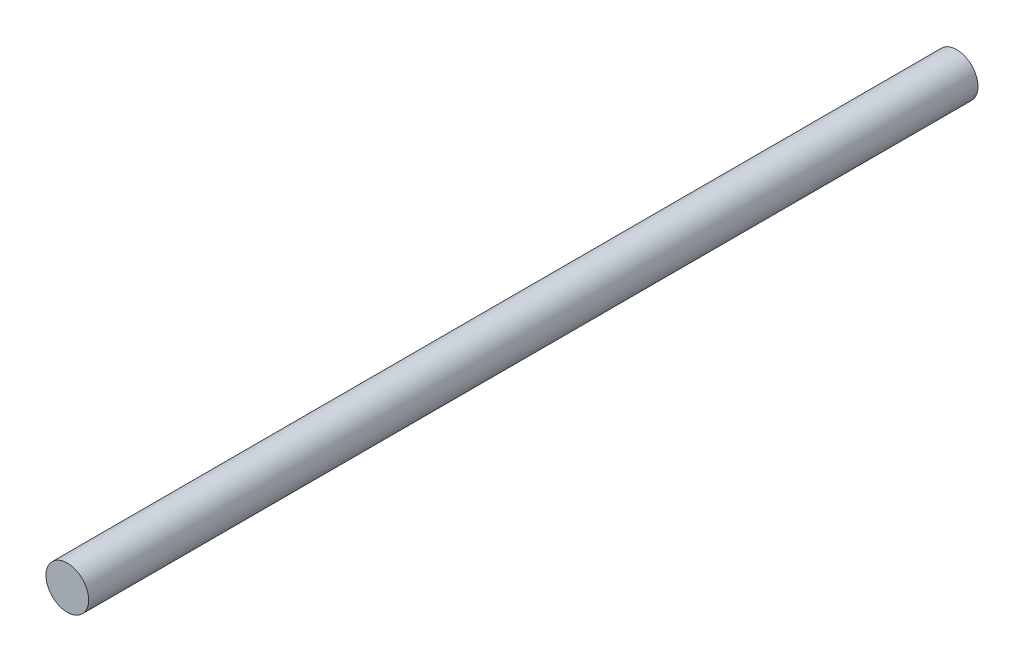
from build123d import *

# Parameters (mm, degrees)
SKETCH1_R           = 3
BOSS_EXTRUDE1_DEPTH = 125


with BuildPart() as part:
    # Sketch1 → Boss-Extrude1 (new body)
    with BuildSketch(Plane.XY):
        Circle(SKETCH1_R)
    extrude(amount=BOSS_EXTRUDE1_DEPTH)


solid = part.part
